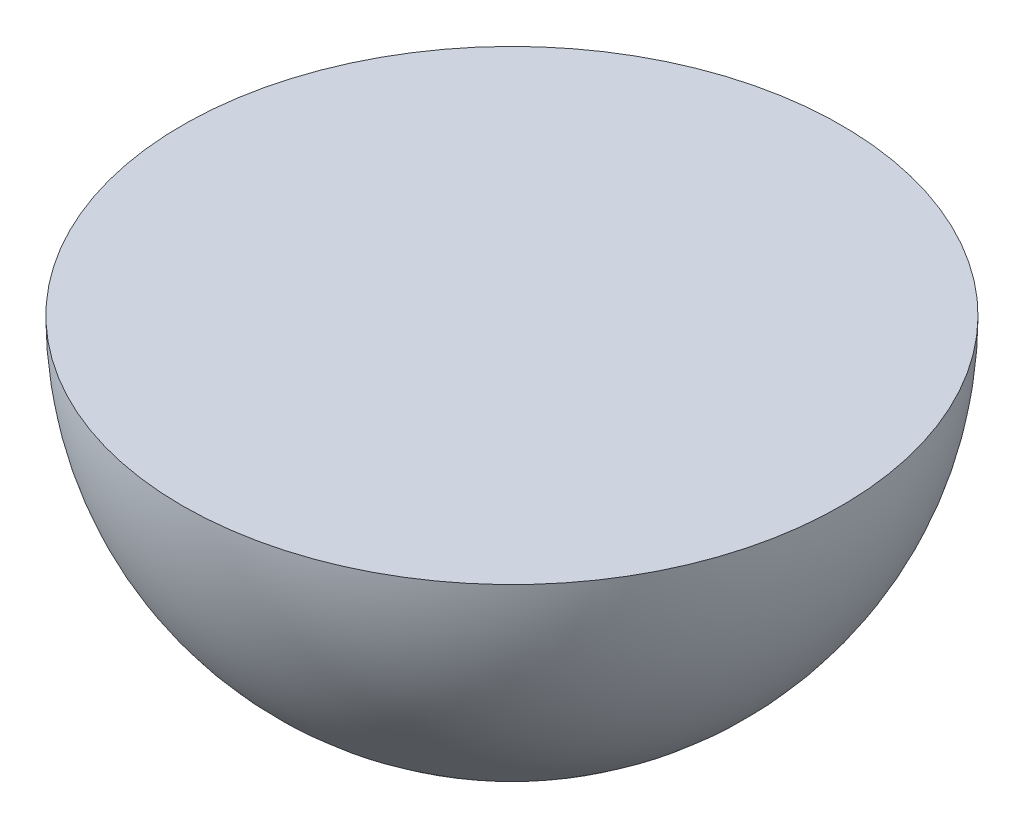
from build123d import *


with BuildPart() as part:
    # Sketch1 → Revolve1 (revolve)
    with BuildSketch(Plane(origin=(0, 0, 0), x_dir=(0, 0, -1), z_dir=(1, 0, 0))):
        with BuildLine():
            Line((-325, 1.630434783), (-425, 1.630434783))
            ThreePointArc((-425, 1.630434783), (-395.710678119, -69.080243336), (-325, -98.369565217))
            Line((-325, -98.369565217), (-325, 1.630434783))
        make_face()
    revolve(axis=Axis((0, 77.231866008, 325), (0, -1, 0)))


solid = part.part
